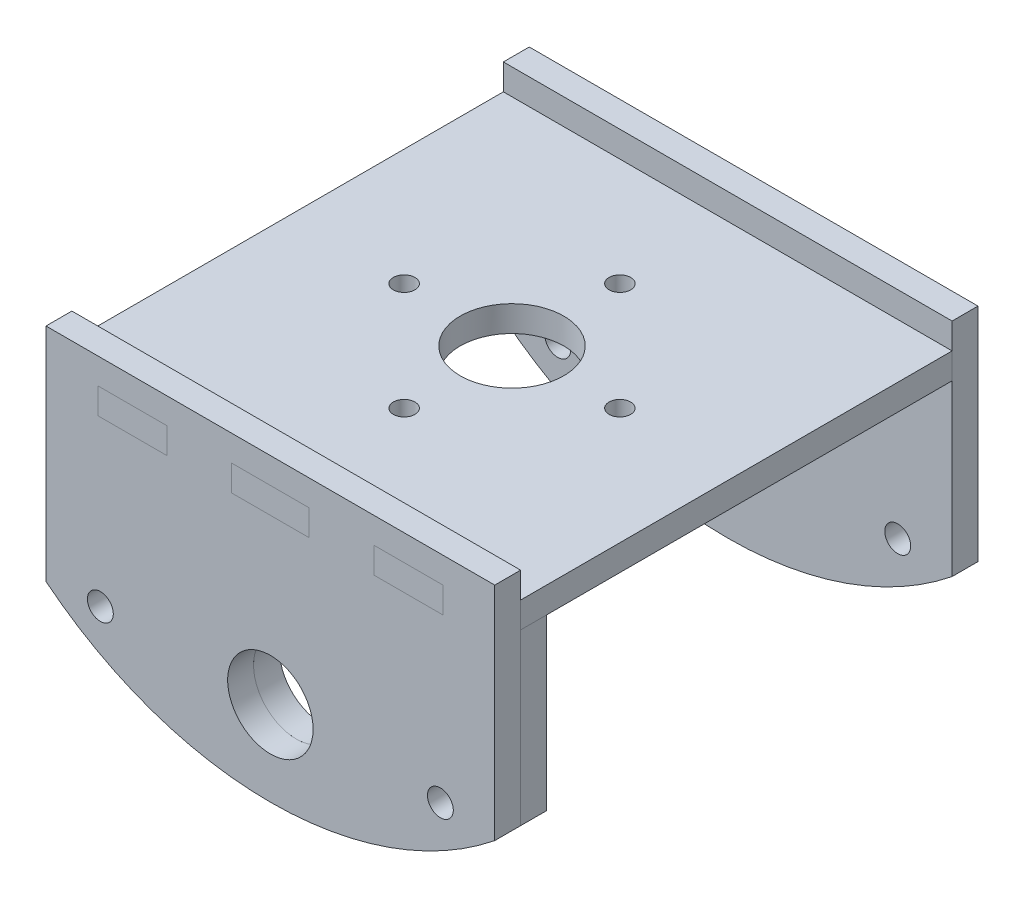
from build123d import *

# Parameters (mm, degrees)
SKETCH_1_R                = 1.5
SKETCH_1_R_2              = 2.5
EXTRUDE_1_DEPTH           = 3
EXTRUDE_START             = -5
SKETCH_2_R                = 2.5
SKETCH_2_R_2              = 1.5
EXTRUDE_6_DEPTH           = 5
SKETCH_5_W                = 62
SKETCH_5_H                = 30
CUT_EXTRUDE_1_DEPTH       = 2
SKETCH_6_W                = 10
SKETCH_6_H                = 3
CUT_EXTRUDE_2_DEPTH       = 10
SKETCH_8_W                = 5
SKETCH_8_H                = 30
CUT_EXTRUDE_3_DEPTH       = 13
PATTERN_LINEAR_1_COUNT    = 2
PATTERN_LINEAR_1_PITCH    = 61
CUT_EXTRUDE_9_DEPTH       = 3
CUT_EXTRUDE_10_DEPTH      = 78.681979892
CUT_EXTRUDE_10_DEPTH_BACK = 3
SKETCH_14_W               = 10
SKETCH_14_H               = 3
EXTRUDE_7_DEPTH           = 3
SKETCH_16_W               = 52
SKETCH_16_H               = 3
EXTRUDE_8_DEPTH           = 10
SKETCH_17_W               = 52
SKETCH_17_H               = 3
EXTRUDE_9_DEPTH           = 10
SKETCH_18_W               = 8
SKETCH_18_H               = 3
SKETCH_18_W_2             = 9
CUT_EXTRUDE_11_DEPTH      = 92
EXTRUDE_10_DEPTH          = 3
EXTRUDE_11_DEPTH          = 3
SKETCH_22_W               = 186.911314513
SKETCH_22_H               = 209.890351
CUT_EXTRUDE_12_DEPTH      = 32
SKETCH_23_W               = 36
SKETCH_23_H               = 45.580870686
CUT_EXTRUDE_13_DEPTH      = 32
SKETCH_24_R               = 6
CUT_EXTRUDE_14_DEPTH      = 70
SKETCH_25_R               = 1.25
CUT_EXTRUDE_15_DEPTH      = 70
SKETCH_26_R               = 4.95
CUT_EXTRUDE_16_DEPTH      = 70
SKETCH_27_W               = 3
SKETCH_27_H               = 22.790435343
EXTRUDE_12_DEPTH          = 2
SKETCH_28_W               = 3
SKETCH_28_H               = 22.790435343
EXTRUDE_13_DEPTH          = 2
SKETCH_29_W               = 52
SKETCH_29_H               = 3
EXTRUDE_14_DEPTH          = 2
SKETCH_30_W               = 20
SKETCH_30_H               = 3
EXTRUDE_15_DEPTH          = 2
CUT_EXTRUDE_18_DEPTH      = 12
CUT_EXTRUDE_START         = -12
CUT_EXTRUDE_19_DEPTH      = 12
SKETCH_33_R               = 17.058294543
EXTRUDE_16_DEPTH          = 3
SKETCH_34_R               = 56.337564476
CUT_EXTRUDE_20_DEPTH      = 7
CUT_EXTRUDE_START_2       = -5
CUT_EXTRUDE_21_DEPTH      = 5
CUT_EXTRUDE_23_DEPTH      = 5
SKETCH_39_R               = 6
CUT_EXTRUDE_24_DEPTH      = 5
SKETCH_40_R               = 1.5
SKETCH_40_R_2             = 4.95
EXTRUDE_17_DEPTH          = 3
SKETCH_41_R               = 1.25
CUT_EXTRUDE_25_DEPTH      = 3


with BuildPart() as part:
    # 草图1 → 凸台-拉伸1 (new body)
    with BuildSketch(Plane.XY):
        with BuildLine():
            Line((-5.3, 6), (44.7, 6))
            ThreePointArc((44.7, 6), (50.7, 0), (44.7, -6))
            Line((44.7, -6), (-5.3, -6))
            ThreePointArc((-5.3, -6), (-11.3, 0), (-5.3, 6))
        make_face()
        Circle(SKETCH_1_R, mode=Mode.SUBTRACT)
        with Locations((39.4, 0)):
            Circle(SKETCH_1_R, mode=Mode.SUBTRACT)
        with Locations((19.7, 0)):
            Circle(SKETCH_1_R_2, mode=Mode.SUBTRACT)
    extrude(amount=EXTRUDE_1_DEPTH)

    # 草图2 → 凸台-拉伸6 (add)
    # profile 1 of 3: a face of its own
    with BuildSketch(Plane.XY.offset(3).offset(EXTRUDE_START)):
        with BuildLine():
            Line((-11.3, 15), (-11.3, 3.3e-08))
            ThreePointArc((-11.3, 3.3e-08), (-9.542640675, 4.242640699), (-5.3, 6))
            Line((-5.3, 6), (44.7, 6))
            ThreePointArc((44.7, 6), (48.942640687, 4.242640687), (50.7, 0))
            Line((50.7, 0), (50.7, 15))
            Line((50.7, 15), (-11.3, 15))
        make_face()
    # profile 2 of 3: a face of its own
    with BuildSketch(Plane.XY.offset(3).offset(EXTRUDE_START)):
        with BuildLine():
            Line((44.7, 6), (-5.3, 6))
            ThreePointArc((-5.3, 6), (-11.3, 0), (-5.3, -6))
            Line((-5.3, -6), (44.7, -6))
            ThreePointArc((44.7, -6), (50.7, 0), (44.7, 6))
        make_face()
        with Locations((19.7, 0)):
            Circle(SKETCH_2_R, mode=Mode.SUBTRACT)
        Circle(SKETCH_2_R_2, mode=Mode.SUBTRACT)
        with Locations((39.4, 0)):
            Circle(SKETCH_2_R_2, mode=Mode.SUBTRACT)
    # profile 3 of 3: a face of its own
    with BuildSketch(Plane.XY.offset(3).offset(EXTRUDE_START)):
        with BuildLine():
            Line((-11.3, 3.3e-08), (-11.3, -15))
            Line((-11.3, -15), (50.7, -15))
            Line((50.7, -15), (50.7, 0))
            ThreePointArc((50.7, 0), (48.942640687, -4.242640687), (44.7, -6))
            Line((44.7, -6), (-5.3, -6))
            ThreePointArc((-5.3, -6), (-9.542640699, -4.242640675), (-11.3, 3.3e-08))
        make_face()
    extrude(amount=EXTRUDE_6_DEPTH)

    # 草图5 → 切除-拉伸1 (cut)
    with BuildSketch(Plane(origin=(0, 0, -2), x_dir=(-1, 0, 0), z_dir=(0, 0, -1))):
        with Locations((-19.7, 0)):
            Rectangle(SKETCH_5_W, SKETCH_5_H)
    extrude(amount=-CUT_EXTRUDE_1_DEPTH, mode=Mode.SUBTRACT)

    # 草图6 → 切除-拉伸2 (cut)
    with BuildSketch(Plane(origin=(0, 0, 0), x_dir=(-1, 0, 0), z_dir=(0, 0, -1))):
        with Locations((-37.7, 10.5)):
            Rectangle(SKETCH_6_W, SKETCH_6_H)
        with Locations((-19.7, 10.5)):
            Rectangle(SKETCH_6_W, SKETCH_6_H)
        with Locations((-1.7, 10.5)):
            Rectangle(SKETCH_6_W, SKETCH_6_H)
    extrude(amount=-CUT_EXTRUDE_2_DEPTH, mode=Mode.SUBTRACT)

    # 草图8 → 切除-拉伸3 (cut)
    with BuildSketch(Plane.XY.offset(3)):
        with Locations((-8.8, 0)):
            Rectangle(SKETCH_8_W, SKETCH_8_H)
        with Locations((48.2, 0)):
            Rectangle(SKETCH_8_W, SKETCH_8_H)
    extrude(amount=-CUT_EXTRUDE_3_DEPTH, mode=Mode.SUBTRACT)


with BuildPart() as pattern_linear_1_1:
    # 阵列(线性)1: pattern copy
    add(part.part.moved(Location(Vector(0, 0, 1) * (1 * PATTERN_LINEAR_1_PITCH))))

    # 草图12 → 切除-拉伸9 (cut)
    with BuildSketch(Plane.XY.offset(64)):
        with BuildLine():
            Line((-6.3, -15), (19.7, -15))
            ThreePointArc((19.7, -15), (4.683324043, -10.971127107), (-6.3, 0.033370453))
            Line((-6.3, 0.033370453), (-6.3, -15))
        make_face()
        with BuildLine():
            Line((45.7, -15), (45.7, 0.033370453))
            ThreePointArc((45.7, 0.033370453), (34.716675957, -10.971127107), (19.7, -15))
            Line((19.7, -15), (45.7, -15))
        make_face()
    extrude(amount=-CUT_EXTRUDE_9_DEPTH, mode=Mode.SUBTRACT)


with BuildPart() as part_1:
    add(part.part)

    # 草图13 → 切除-拉伸10 (cut, two sides: drawn at the far end of the back side and taken through both)
    with BuildSketch(Plane.XY.offset(3).offset(-CUT_EXTRUDE_10_DEPTH_BACK)):
        with BuildLine():
            ThreePointArc((19.7, -15), (4.683324043, -10.971127107), (-6.3, 0.033370453))
            Line((-6.3, 0.033370453), (-6.3, -15))
            Line((-6.3, -15), (19.7, -15))
        make_face()
        with BuildLine():
            ThreePointArc((45.7, 0.033370453), (34.716675957, -10.971127107), (19.7, -15))
            Line((19.7, -15), (45.7, -15))
            Line((45.7, -15), (45.7, 0.033370453))
        make_face()
    extrude(amount=CUT_EXTRUDE_10_DEPTH + CUT_EXTRUDE_10_DEPTH_BACK, mode=Mode.SUBTRACT)

    add(pattern_linear_1_1.part)  # 凸台-拉伸7 merges 阵列(线性)1_1
    # 草图14 → 凸台-拉伸7 (add)
    with BuildSketch(Plane(origin=(0, 9, 0), x_dir=(1, 0, 0), z_dir=(0, 1, 0))):
        with Locations((37.7, -62.5)):
            Rectangle(SKETCH_14_W, SKETCH_14_H)
        with Locations((1.7, -1.5)):
            Rectangle(SKETCH_14_W, SKETCH_14_H)
        with Locations((19.7, -1.5)):
            Rectangle(SKETCH_14_W, SKETCH_14_H)
        with Locations((37.7, -1.5)):
            Rectangle(SKETCH_14_W, SKETCH_14_H)
        with Locations((1.7, -62.5)):
            Rectangle(SKETCH_14_W, SKETCH_14_H)
        with Locations((19.7, -62.5)):
            Rectangle(SKETCH_14_W, SKETCH_14_H)
    extrude(amount=EXTRUDE_7_DEPTH)

    # 草图16 → 凸台-拉伸8 (add)
    with BuildSketch(Plane(origin=(0, 15, 0), x_dir=(1, 0, 0), z_dir=(0, 1, 0))):
        with Locations((19.7, -62.5)):
            Rectangle(SKETCH_16_W, SKETCH_16_H)
    extrude(amount=EXTRUDE_8_DEPTH)

    # 草图17 → 凸台-拉伸9 (add)
    with BuildSketch(Plane(origin=(0, 15, 0), x_dir=(1, 0, 0), z_dir=(0, 1, 0))):
        with Locations((19.7, -1.5)):
            Rectangle(SKETCH_17_W, SKETCH_17_H)
    extrude(amount=EXTRUDE_9_DEPTH)

    # 草图18 → 切除-拉伸11 (cut)
    with BuildSketch(Plane(origin=(0, 0, 0), x_dir=(-1, 0, 0), z_dir=(0, 0, -1))):
        with Locations((-35.7, 20.5)):
            Rectangle(SKETCH_18_W, SKETCH_18_H)
        with Locations((-19.7, 20.5)):
            Rectangle(SKETCH_18_W_2, SKETCH_18_H)
        with Locations((-3.7, 20.5)):
            Rectangle(SKETCH_18_W, SKETCH_18_H)
    extrude(amount=-CUT_EXTRUDE_11_DEPTH, mode=Mode.SUBTRACT)

    # 草图21 → 凸台-拉伸11 (add)
    with BuildSketch(Plane.XY.offset(64)):
        Polygon((-6.3, 0.033370453), (-6.3, -7.790435343), (45.7, -7.790435343), (45.7, 0.033370453), (28.488176581, -6.055190285), (-2.858185747, -2.304821935), align=None)
    extrude(amount=-EXTRUDE_11_DEPTH)

    # 草图22 → 切除-拉伸12 (cut)
    with BuildSketch(Plane.XZ.offset(7.790435343)):
        with Locations((-1.99778524, 62.455941245)):
            Rectangle(SKETCH_22_W, SKETCH_22_H)
    extrude(amount=CUT_EXTRUDE_12_DEPTH, mode=Mode.SUBTRACT)

    # 草图23 → 切除-拉伸13 (cut)
    with BuildSketch(Plane(origin=(0, 0, 0), x_dir=(-1, 0, 0), z_dir=(0, 0, -1))):
        with Locations((-45.7, -7.790435343)):
            Rectangle(SKETCH_23_W, SKETCH_23_H)
        with Locations((6.3, -7.790435343)):
            Rectangle(SKETCH_23_W, SKETCH_23_H)
    extrude(amount=-CUT_EXTRUDE_13_DEPTH, mode=Mode.SUBTRACT)

    # 草图26 → 切除-拉伸16 (cut)
    with BuildSketch(Plane.XY.offset(64)):
        with Locations((19.7, 0)):
            Circle(SKETCH_26_R)
    extrude(amount=-CUT_EXTRUDE_16_DEPTH, mode=Mode.SUBTRACT)

    # 草图27 → 凸台-拉伸12 (add)
    with BuildSketch(Plane.ZY.offset(-11.7)):
        with Locations((1.5, 3.604782329)):
            Rectangle(SKETCH_27_W, SKETCH_27_H)
    extrude(amount=EXTRUDE_12_DEPTH)

    # 草图28 → 凸台-拉伸13 (add)
    with BuildSketch(Plane(origin=(27.7, 0, 0), x_dir=(0, 0, -1), z_dir=(1, 0, 0))):
        with Locations((-1.5, 3.604782329)):
            Rectangle(SKETCH_28_W, SKETCH_28_H)
    extrude(amount=EXTRUDE_13_DEPTH)

    # 草图29 → 凸台-拉伸14 (add)
    with BuildSketch(Plane.XZ.offset(7.790435343)):
        with Locations((19.7, 62.5)):
            Rectangle(SKETCH_29_W, SKETCH_29_H)
    extrude(amount=EXTRUDE_14_DEPTH)

    # 草图30 → 凸台-拉伸15 (add)
    with BuildSketch(Plane.XZ.offset(7.790435343)):
        with Locations((19.7, 1.5)):
            Rectangle(SKETCH_30_W, SKETCH_30_H)
    extrude(amount=EXTRUDE_15_DEPTH)

    # 草图31 → 切除-拉伸18 (cut)
    with BuildSketch(Plane.XY.offset(64)):
        with BuildLine():
            ThreePointArc((45.7, -0.646199916), (33.480575474, -7.437744554), (19.7, -9.790435343))
            Line((19.7, -9.790435343), (45.7, -9.790435343))
            Line((45.7, -9.790435343), (45.7, -0.646199916))
        make_face()
        with BuildLine():
            ThreePointArc((19.7, -9.790435343), (5.919424526, -7.437744554), (-6.3, -0.646199916))
            Line((-6.3, -0.646199916), (-6.3, -9.790435343))
            Line((-6.3, -9.790435343), (19.7, -9.790435343))
        make_face()
    extrude(amount=-CUT_EXTRUDE_18_DEPTH, mode=Mode.SUBTRACT)

    # 草图32 → 切除-拉伸19 (cut)
    with BuildSketch(Plane(origin=(0, 0, 0), x_dir=(-1, 0, 0), z_dir=(0, 0, -1)).offset(CUT_EXTRUDE_START)):
        with BuildLine():
            Line((-45.7, -0.646199916), (-43.950258349, -12.650491263))
            Line((-43.950258349, -12.650491263), (6.3, -16.622113536))
            Line((6.3, -16.622113536), (6.3, -0.646199916))
            ThreePointArc((6.3, -0.646199916), (-19.7, -9.790435343), (-45.7, -0.646199916))
        make_face()
    extrude(amount=CUT_EXTRUDE_19_DEPTH, mode=Mode.SUBTRACT)


with BuildPart() as body_2:
    # 草图19 → 凸台-拉伸10 (new body)
    with BuildSketch(Plane(origin=(0, 19, 0), x_dir=(1, 0, 0), z_dir=(0, 1, 0))):
        Polygon((39.7, -3), (39.7, 0), (31.7, 0), (31.7, -3), (24.2, -3), (24.2, 0), (15.2, 0), (15.2, -3), (7.7, -3), (7.7, 0), (-0.3, 0), (-0.3, -3), (-6.3, -3), (-6.3, -61), (-0.3, -61), (-0.3, -64), (7.7, -64), (7.7, -61), (15.2, -61), (15.2, -64), (24.2, -64), (24.2, -61), (31.7, -61), (31.7, -64), (39.7, -64), (39.7, -61), (45.7, -61), (45.7, -3), align=None)
    extrude(amount=EXTRUDE_10_DEPTH)

    # 草图24 → 切除-拉伸14 (cut)
    with BuildSketch(Plane(origin=(0, 22, 0), x_dir=(1, 0, 0), z_dir=(0, 1, 0))):
        with Locations(Location((19.7, -32, 0), (0, 0, 270))):
            Circle(SKETCH_24_R)
    extrude(amount=-CUT_EXTRUDE_14_DEPTH, mode=Mode.SUBTRACT)

    # 草图25 → 切除-拉伸15 (cut)
    with BuildSketch(Plane(origin=(0, 22, 0), x_dir=(1, 0, 0), z_dir=(0, 1, 0))):
        with Locations(Location((19.7, -19.5, 0), (0, 0, 270))):
            Circle(SKETCH_25_R)
        with Locations(Location((7.2, -32, 0), (0, 0, 270))):
            Circle(SKETCH_25_R)
        with Locations(Location((19.7, -44.5, 0), (0, 0, 270))):
            Circle(SKETCH_25_R)
        with Locations(Location((32.2, -32, 0), (0, 0, 270))):
            Circle(SKETCH_25_R)
    extrude(amount=-CUT_EXTRUDE_15_DEPTH, mode=Mode.SUBTRACT)

    # 草图33 → 凸台-拉伸16 (add)
    with BuildSketch(Plane(origin=(0, 22, 0), x_dir=(1, 0, 0), z_dir=(0, 1, 0))):
        with Locations((19.7, -32)):
            Circle(SKETCH_33_R)
    extrude(amount=-EXTRUDE_16_DEPTH)


with BuildPart() as cut_extrude_20_tool:
    # 草图34 → 切除-拉伸20 (new body)
    with BuildSketch(Plane(origin=(0, 0, 0), x_dir=(-1, 0, 0), z_dir=(0, 0, -1))):
        with Locations((-20.233447846, 12.47883322)):
            Circle(SKETCH_34_R)
    extrude(amount=-CUT_EXTRUDE_20_DEPTH)


with BuildPart() as part_2:
    add(part_1.part)

    # 切除-拉伸20: cut by cut_extrude_20_tool
    add(cut_extrude_20_tool.part, mode=Mode.SUBTRACT)


with BuildPart() as body_2_1:
    add(body_2.part)

    # 切除-拉伸20: cut by cut_extrude_20_tool
    add(cut_extrude_20_tool.part, mode=Mode.SUBTRACT)

    # 镜向1: body 2 across plane


with BuildPart() as body_2_2:
    add(body_2_1.part)
    add(body_2_1.part.mirror(Plane.XY.offset(34)))


with BuildPart() as body_3:
    # 镜向2: mirrored copy
    add(part_2.part.mirror(Plane.XY.offset(34)))


with BuildPart() as cut_extrude_21_tool:
    # 草图36 → 切除-拉伸21 (new body)
    with BuildSketch(Plane(origin=(0, 0, 4), x_dir=(-1, 0, 0), z_dir=(0, 0, -1)).offset(CUT_EXTRUDE_START_2)):
        with BuildLine():
            Line((6.3, -0.646199916), (6.3, 25))
            Line((6.3, 25), (-45.7, 25))
            Line((-45.7, 25), (-45.7, -0.646199916))
            ThreePointArc((-45.7, -0.646199916), (-19.7, -9.790435343), (6.3, -0.646199916))
        make_face()
    extrude(amount=CUT_EXTRUDE_21_DEPTH)


with BuildPart() as body_2_3:
    add(body_2_2.part)

    # 切除-拉伸21: cut by cut_extrude_21_tool
    add(cut_extrude_21_tool.part, mode=Mode.SUBTRACT)

    # 镜向3: body 2 across plane


with BuildPart() as body_3_1:
    add(body_3.part)

    # 切除-拉伸21: cut by cut_extrude_21_tool
    add(cut_extrude_21_tool.part, mode=Mode.SUBTRACT)


with BuildPart() as body_2_4:
    add(body_2_3.part)
    add(body_2_3.part.mirror(Plane(origin=(0, 0, 35), x_dir=(1, 0, 0), z_dir=(0, 0, -1))))


with BuildPart() as body_3_2:
    # 镜向4: mirrored copy
    add(part_2.part.mirror(Plane(origin=(0, 0, 35), x_dir=(1, 0, 0), z_dir=(0, 0, -1))))


with BuildPart() as cut_extrude_23_tool:
    # 草图38 → 切除-拉伸23 (new body)
    with BuildSketch(Plane(origin=(0, 0, 6), x_dir=(-1, 0, 0), z_dir=(0, 0, -1)).offset(CUT_EXTRUDE_START_2)):
        with BuildLine():
            Line((6.3, -0.646199916), (6.3, 25))
            Line((6.3, 25), (-45.7, 25))
            Line((-45.7, 25), (-45.7, -0.646199916))
            ThreePointArc((-45.7, -0.646199916), (-19.7, -9.790435343), (6.3, -0.646199916))
        make_face()
    extrude(amount=CUT_EXTRUDE_23_DEPTH)


with BuildPart() as body_2_5:
    add(body_2_4.part)

    # 切除-拉伸23: cut by cut_extrude_23_tool
    add(cut_extrude_23_tool.part, mode=Mode.SUBTRACT)

    # 镜向5: body 2 across plane


with BuildPart() as body_3_2_1:
    add(body_3_2.part)

    # 切除-拉伸23: cut by cut_extrude_23_tool
    add(cut_extrude_23_tool.part, mode=Mode.SUBTRACT)


with BuildPart() as body_2_6:
    add(body_2_5.part)
    add(body_2_5.part.mirror(Plane.XY.offset(36)))

    # 草图39 → 切除-拉伸24 (cut)
    with BuildSketch(Plane(origin=(0, 22, 0), x_dir=(1, 0, 0), z_dir=(0, 1, 0))):
        with Locations(Location((19.7, -36, 0), (0, 0, 270))):
            Circle(SKETCH_39_R)
    extrude(amount=-CUT_EXTRUDE_24_DEPTH, mode=Mode.SUBTRACT)

    # 草图41 → 切除-拉伸25 (cut)
    with BuildSketch(Plane(origin=(0, 22, 0), x_dir=(1, 0, 0), z_dir=(0, 1, 0))):
        with Locations(Location((19.7, -23.5, 0), (0, 0, 270))):
            Circle(SKETCH_41_R)
        with Locations(Location((7.2, -36, 0), (0, 0, 270))):
            Circle(SKETCH_41_R)
        with Locations(Location((19.7, -48.5, 0), (0, 0, 270))):
            Circle(SKETCH_41_R)
        with Locations(Location((32.2, -36, 0), (0, 0, 270))):
            Circle(SKETCH_41_R)
    extrude(amount=-CUT_EXTRUDE_25_DEPTH, mode=Mode.SUBTRACT)


with BuildPart() as body_3_3:
    # 镜向6: mirrored copy
    add(part_2.part.mirror(Plane.XY.offset(36)))


with BuildPart() as body_4:
    # 草图40 → 凸台-拉伸17 (new body)
    with BuildSketch(Plane(origin=(0, 0, 61), x_dir=(-1, 0, 0), z_dir=(0, 0, -1))):
        with BuildLine():
            Line((-45.7, 19), (6.3, 19))
            Line((6.3, 19), (6.3, -0.646199916))
            ThreePointArc((6.3, -0.646199916), (-19.7, -9.790435343), (-45.7, -0.646199916))
            Line((-45.7, -0.646199916), (-45.7, 19))
        make_face()
        with Locations((-39.4, 0)):
            Circle(SKETCH_40_R, mode=Mode.SUBTRACT)
        with Locations((-19.7, 0)):
            Circle(SKETCH_40_R_2, mode=Mode.SUBTRACT)
        Circle(SKETCH_40_R, mode=Mode.SUBTRACT)
    extrude(amount=EXTRUDE_17_DEPTH)


solid = Compound([part_2.part, body_2_6.part, body_3_3.part, body_4.part])
